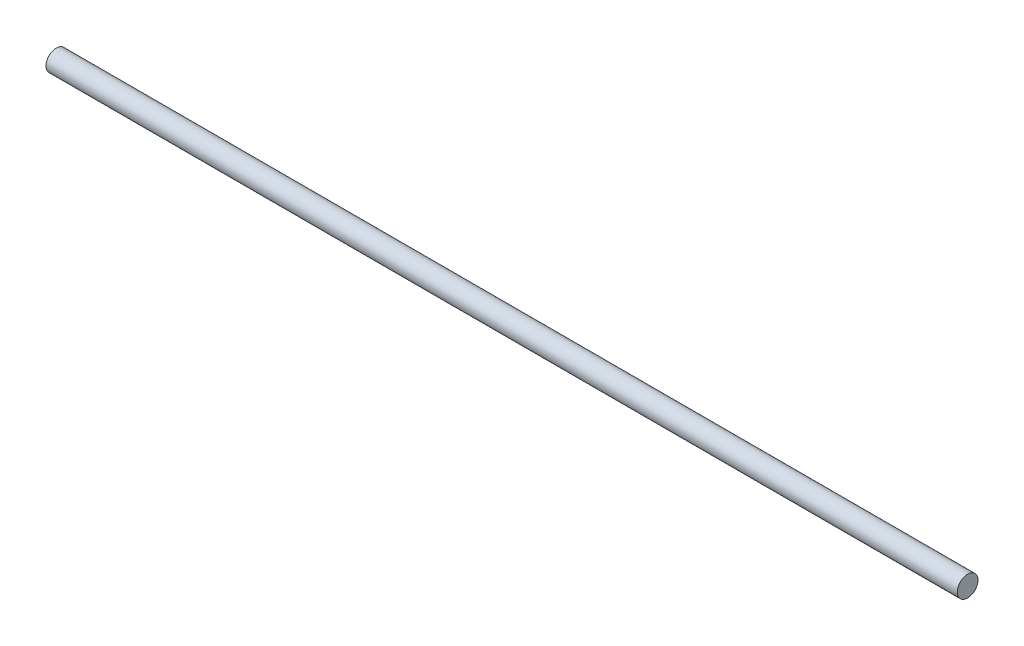
from build123d import *

# Parameters (mm, degrees)
SKETCH1_R           = 1.25
BOSS_EXTRUDE1_DEPTH = 110


with BuildPart() as part:
    # Sketch1 → Boss-Extrude1 (new body)
    with BuildSketch(Plane(origin=(0, 0, 0), x_dir=(0, 0, -1), z_dir=(1, 0, 0))):
        Circle(SKETCH1_R)
    extrude(amount=BOSS_EXTRUDE1_DEPTH)


solid = part.part
